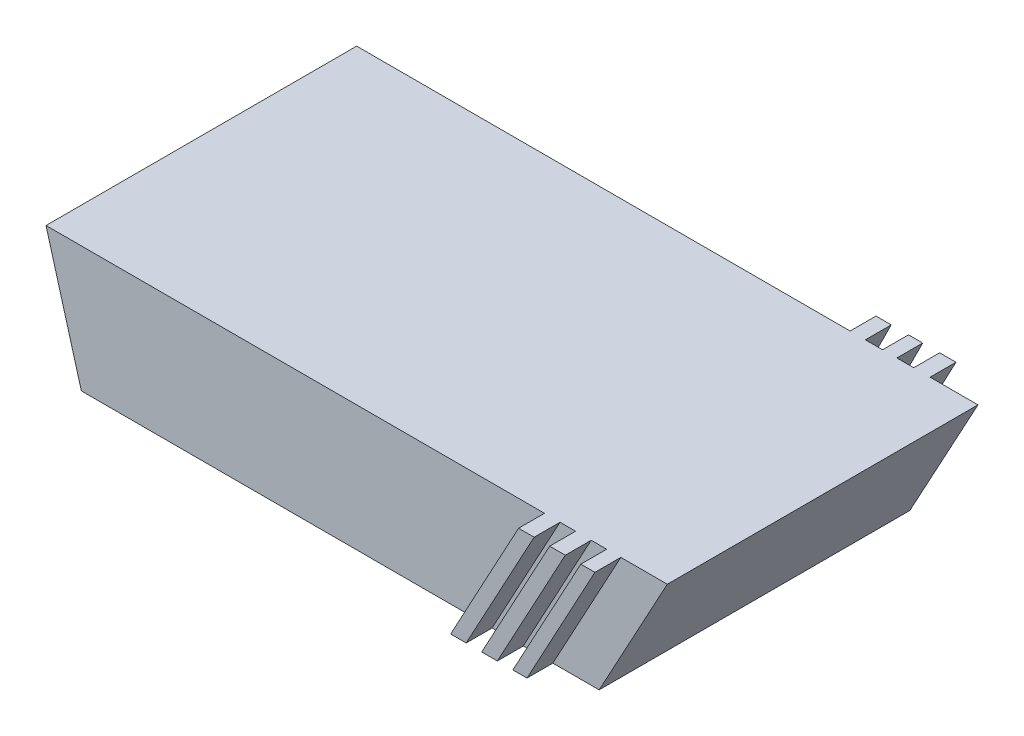
from build123d import *

# Parameters (mm, degrees)
BOSS_EXTRUDE1_DEPTH = 152.4
BOSS_EXTRUDE2_DEPTH = 12.7
BOSS_EXTRUDE4_DEPTH = 12.7


with BuildPart() as part:
    # Sketch1 → Boss-Extrude1 (new body)
    with BuildSketch(Plane.XY):
        Polygon((-67.57780806, 32.405365497), (237.22219194, 32.405365497), (203.770487766, -29.214920061), (-50.229512234, -29.214920061), align=None)
    extrude(amount=BOSS_EXTRUDE1_DEPTH)

    # Sketch2 → Boss-Extrude2 (add)
    with BuildSketch(Plane.XY.offset(152.4)):
        Polygon((181.065122105, -29.214920061), (214.407517956, 32.405365497), (207.478022529, 32.405365497), (174.135626677, -29.214920061), align=None)
        Polygon((166.529193842, -29.214920061), (199.871589694, 32.405365497), (192.204880741, 32.405365497), (158.862484889, -29.214920061), align=None)
        Polygon((151.231941607, -29.214920061), (184.574337458, 32.405365497), (176.954337458, 32.405365497), (143.611941607, -29.214920061), align=None)
    extrude(amount=BOSS_EXTRUDE2_DEPTH)

    # Sketch4 → Boss-Extrude4 (add)
    with BuildSketch(Plane(origin=(0, 0, 0), x_dir=(-1, 0, 0), z_dir=(0, 0, -1))):
        Polygon((-213.709292703, 32.405365497), (-181.065122105, -29.214920061), (-174.135626677, -29.214920061), (-205.699290692, 32.405365497), align=None)
        Polygon((-197.403182961, 32.405365497), (-166.529193842, -29.214920061), (-158.862484889, -29.214920061), (-190.426148903, 32.405365497), align=None)
        Polygon((-181.966188402, 32.405365497), (-151.231941607, -29.214920061), (-143.611941607, -29.214920061), (-174.485930726, 32.405365497), align=None)
    extrude(amount=BOSS_EXTRUDE4_DEPTH)


solid = part.part
